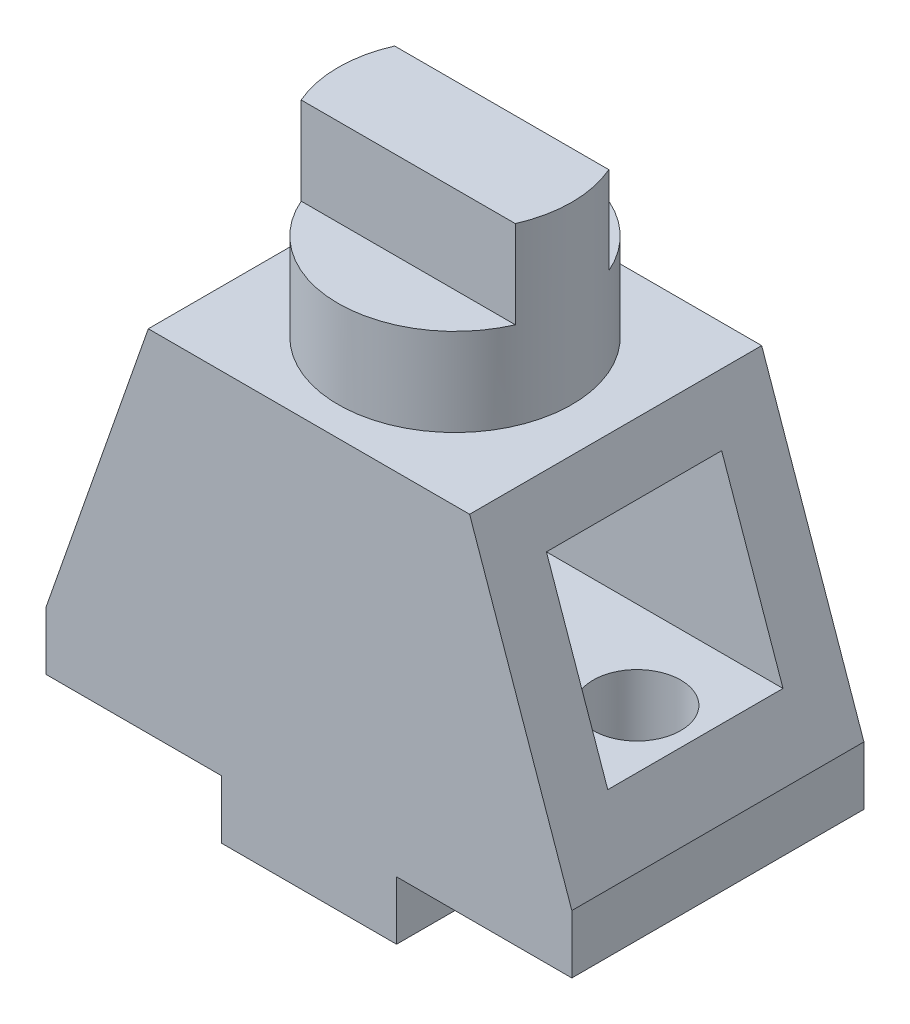
from build123d import *

# Parameters (mm, degrees)
BOSS_EXTRUDE1_DEPTH = 50
SKETCH2_W           = 30
SKETCH2_H           = 30
CUT_EXTRUDE1_DEPTH  = 65
SKETCH3_R           = 7.5
CUT_EXTRUDE2_DEPTH  = 40
SKETCH4_R           = 20
BOSS_EXTRUDE2_DEPTH = 30
CUT_EXTRUDE3_START  = -15
CUT_EXTRUDE3_DEPTH  = 15


with BuildPart() as part:
    # Sketch1 → Boss-Extrude1 (new body)
    with BuildSketch(Plane.XY):
        Polygon((0, 0), (-15, 0), (-15, 10), (-45, 10), (-45, 20), (-27.5, 70), (27.5, 70), (45, 20), (45, 10), (15, 10), (15, 0), align=None)
    extrude(amount=BOSS_EXTRUDE1_DEPTH)

    # Sketch2 → Cut-Extrude1 (cut, symmetric)
    with BuildSketch(Plane(origin=(0, 0, 0), x_dir=(0, 0, -1), z_dir=(1, 0, 0))):
        with Locations((-25, 46)):
            Rectangle(SKETCH2_W, SKETCH2_H)
    extrude(amount=CUT_EXTRUDE1_DEPTH, both=True, mode=Mode.SUBTRACT)

    # Sketch3 → Cut-Extrude2 (cut)
    with BuildSketch(Plane(origin=(0, 0, 0), x_dir=(1, 0, 0), z_dir=(0, 1, 0))):
        with Locations(Location((-31.15, -25, 0), (0, 0, 90))):
            Circle(SKETCH3_R)
        with Locations(Location((31.15, -25, 0), (0, 0, 90))):
            Circle(SKETCH3_R)
    extrude(amount=CUT_EXTRUDE2_DEPTH, mode=Mode.SUBTRACT)

    # Sketch4 → Boss-Extrude2 (add)
    with BuildSketch(Plane(origin=(0, 70, 0), x_dir=(1, 0, 0), z_dir=(0, 1, 0))):
        with Locations(Location((0, -25, 0), (0, 0, 90))):
            Circle(SKETCH4_R)
    extrude(amount=BOSS_EXTRUDE2_DEPTH)

    # Sketch5 → Cut-Extrude3 (cut)
    with BuildSketch(Plane(origin=(0, 100, 0), x_dir=(1, 0, 0), z_dir=(0, 1, 0)).offset(CUT_EXTRUDE3_START)):
        with BuildLine():
            ThreePointArc((18.33030278, -17), (0, -5), (-18.33030278, -17))
            Line((-18.33030278, -17), (18.33030278, -17))
        make_face()
        with BuildLine():
            Line((18.33030278, -33), (-18.33030278, -33))
            ThreePointArc((-18.33030278, -33), (0, -45), (18.33030278, -33))
        make_face()
    extrude(amount=CUT_EXTRUDE3_DEPTH, mode=Mode.SUBTRACT)


solid = part.part
